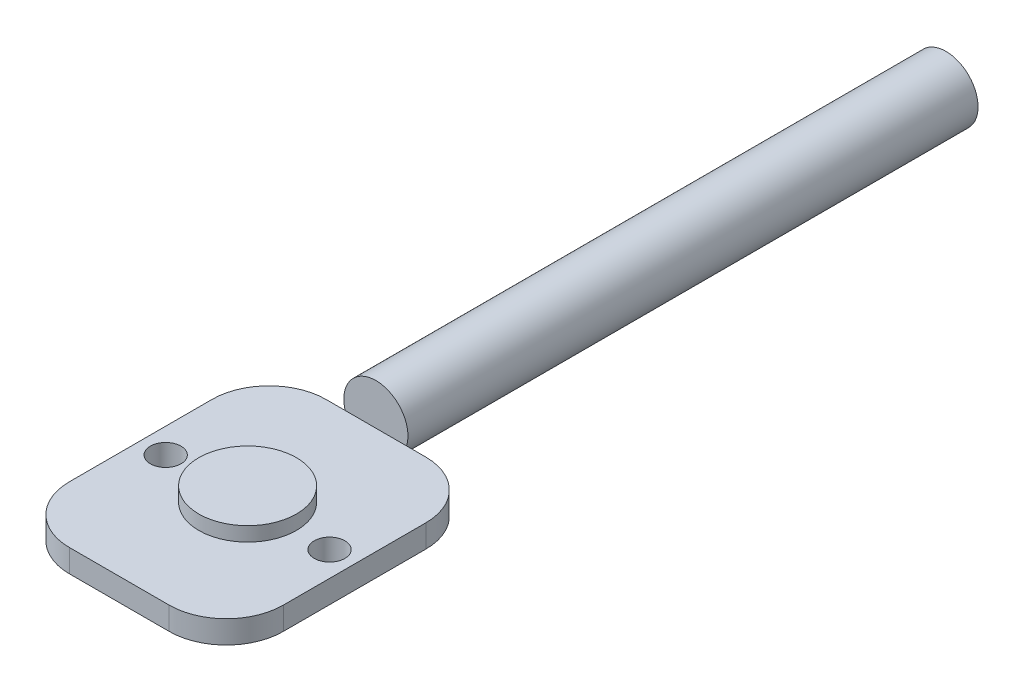
from build123d import *

# Parameters (mm, degrees)
SKETCH1_R           = 1.075
BOSS_EXTRUDE1_DEPTH = 1.6
SKETCH2_R           = 3.426475787
BOSS_EXTRUDE2_DEPTH = 1
SKETCH4_R           = 2.25
BOSS_EXTRUDE3_DEPTH = 40


with BuildPart() as part:
    # Sketch1 → Boss-Extrude1 (new body)
    with BuildSketch(Plane(origin=(0, 0, 0), x_dir=(1, 0, 0), z_dir=(0, 1, 0))):
        with BuildLine():
            Line((-3.5, 9), (3.5, 9))
            ThreePointArc((3.5, 9), (6.328427125, 7.828427125), (7.5, 5))
            Line((7.5, 5), (7.5, -5))
            ThreePointArc((7.5, -5), (6.328427125, -7.828427125), (3.5, -9))
            Line((3.5, -9), (-3.5, -9))
            ThreePointArc((-3.5, -9), (-6.328427125, -7.828427125), (-7.5, -5))
            Line((-7.5, -5), (-7.5, 5))
            ThreePointArc((-7.5, 5), (-6.328427125, 7.828427125), (-3.5, 9))
        make_face()
        with Locations(Location((-5.75, 0, 0), (0, 0, 270))):
            Circle(SKETCH1_R, mode=Mode.SUBTRACT)
        with Locations(Location((5.75, 0, 0), (0, 0, 270))):
            Circle(SKETCH1_R, mode=Mode.SUBTRACT)
    extrude(amount=BOSS_EXTRUDE1_DEPTH)

    # Sketch2 → Boss-Extrude2 (add)
    with BuildSketch(Plane(origin=(0, 1.6, 0), x_dir=(1, 0, 0), z_dir=(0, 1, 0))):
        with Locations(Location((0, 0, 0), (0, 0, 270))):
            Circle(SKETCH2_R)
    extrude(amount=BOSS_EXTRUDE2_DEPTH)


with BuildPart() as body_2:
    # Sketch4 → Boss-Extrude3 (new body)
    with BuildSketch(Plane(origin=(0, 0, -9), x_dir=(-1, 0, 0), z_dir=(0, 0, -1))):
        with Locations((0, 2.25)):
            Circle(SKETCH4_R)
    extrude(amount=BOSS_EXTRUDE3_DEPTH)


solid = Compound([part.part, body_2.part])
